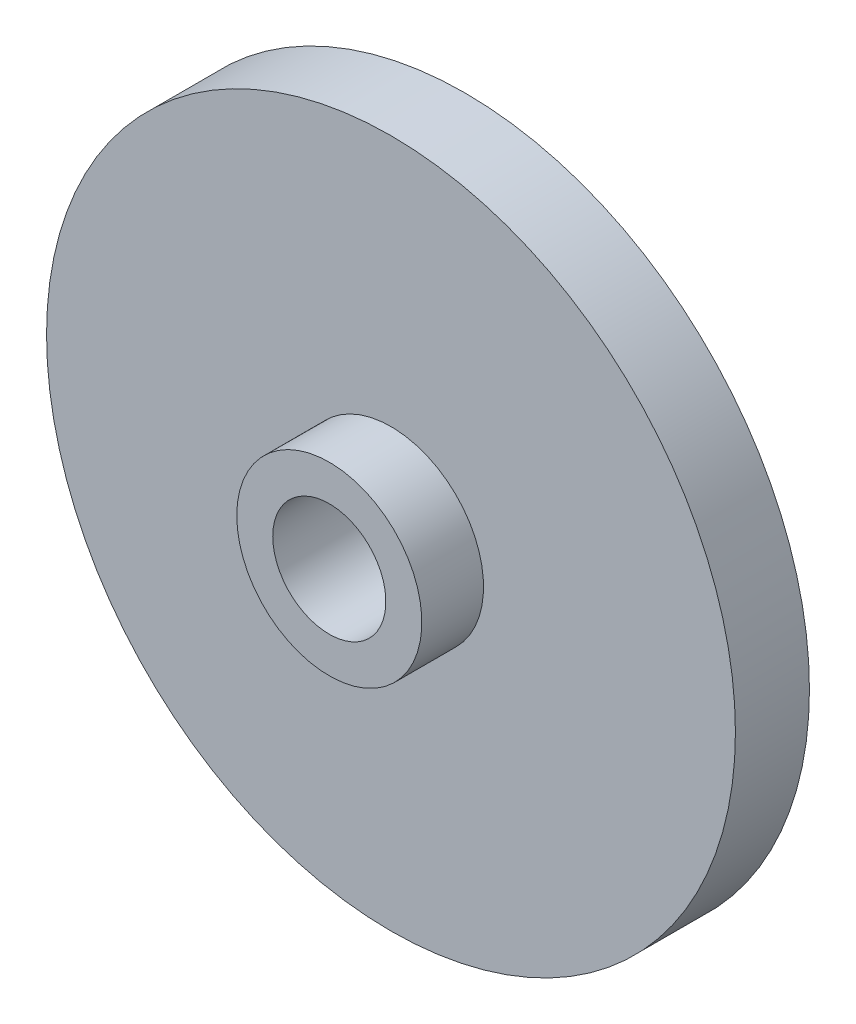
from build123d import *


with BuildPart() as part:
    # Эскиз1 → Повернуть1 (revolve)
    with BuildSketch(Plane.XZ, mode=Mode.PRIVATE) as revolve_1_sk:
        Polygon((4.5, 6.6), (2.75, 6.6), (2.75, -5.5), (3.5, -5.5), (3.5, 0), (16.75, 0), (16.75, 3.6), (4.5, 3.6), align=None)
    revolve(revolve_1_sk.sketch.rotate(Axis((0, 0, 6.6), (0, 0, -1)), 180), axis=Axis((0, 0, 6.6), (0, 0, -1)))


solid = part.part
